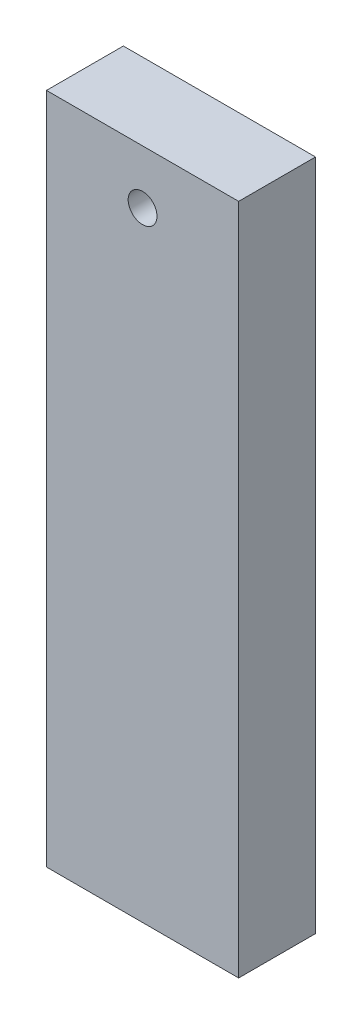
from build123d import *

# Parameters (mm, degrees)
SKETCH1_W           = 50.8
SKETCH1_H           = 20.32
BOSS_EXTRUDE1_DEPTH = 177.8
SKETCH2_R           = 3.81
CUT_EXTRUDE1_DEPTH  = 181.750940247


with BuildPart() as part:
    # Sketch1 → Boss-Extrude1 (new body)
    with BuildSketch(Plane(origin=(0, 0, 0), x_dir=(1, 0, 0), z_dir=(0, 1, 0))):
        Rectangle(SKETCH1_W, SKETCH1_H)
    extrude(amount=BOSS_EXTRUDE1_DEPTH)

    # Sketch2 → Cut-Extrude1 (cut, through all)
    with BuildSketch(Plane(origin=(0, 0, -10.16), x_dir=(-1, 0, 0), z_dir=(0, 0, -1))):
        with Locations((0, 163.576)):
            Circle(SKETCH2_R)
    extrude(amount=-CUT_EXTRUDE1_DEPTH, mode=Mode.SUBTRACT)


solid = part.part
